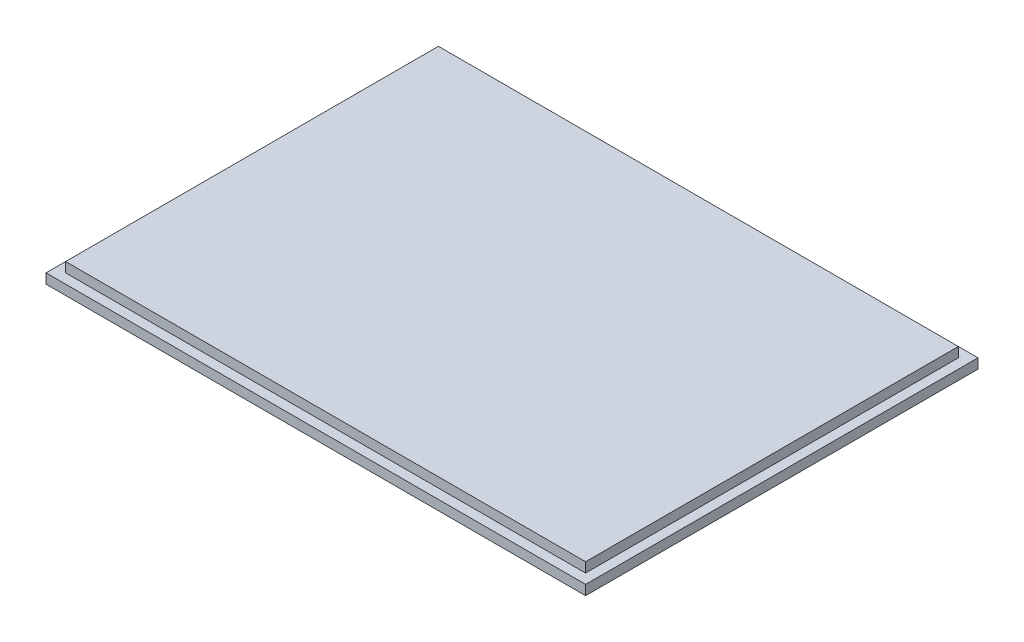
from build123d import *

# Parameters (mm, degrees)
SKETCH1_W           = 220
SKETCH1_H           = 160
BOSS_EXTRUDE1_DEPTH = 8
SKETCH2_W           = 220
SKETCH2_H           = 160
SKETCH2_W_2         = 212
SKETCH2_H_2         = 152
CUT_EXTRUDE1_DEPTH  = 4


with BuildPart() as part:
    # Sketch1 → Boss-Extrude1 (new body)
    with BuildSketch(Plane(origin=(0, 0, 0), x_dir=(1, 0, 0), z_dir=(0, 1, 0))):
        Rectangle(SKETCH1_W, SKETCH1_H)
    extrude(amount=BOSS_EXTRUDE1_DEPTH)

    # Sketch2 → Cut-Extrude1 (cut)
    with BuildSketch(Plane(origin=(0, 8, 0), x_dir=(1, 0, 0), z_dir=(0, 1, 0))):
        Rectangle(SKETCH2_W, SKETCH2_H)
        Rectangle(SKETCH2_W_2, SKETCH2_H_2, mode=Mode.SUBTRACT)
    extrude(amount=-CUT_EXTRUDE1_DEPTH, mode=Mode.SUBTRACT)


solid = part.part
